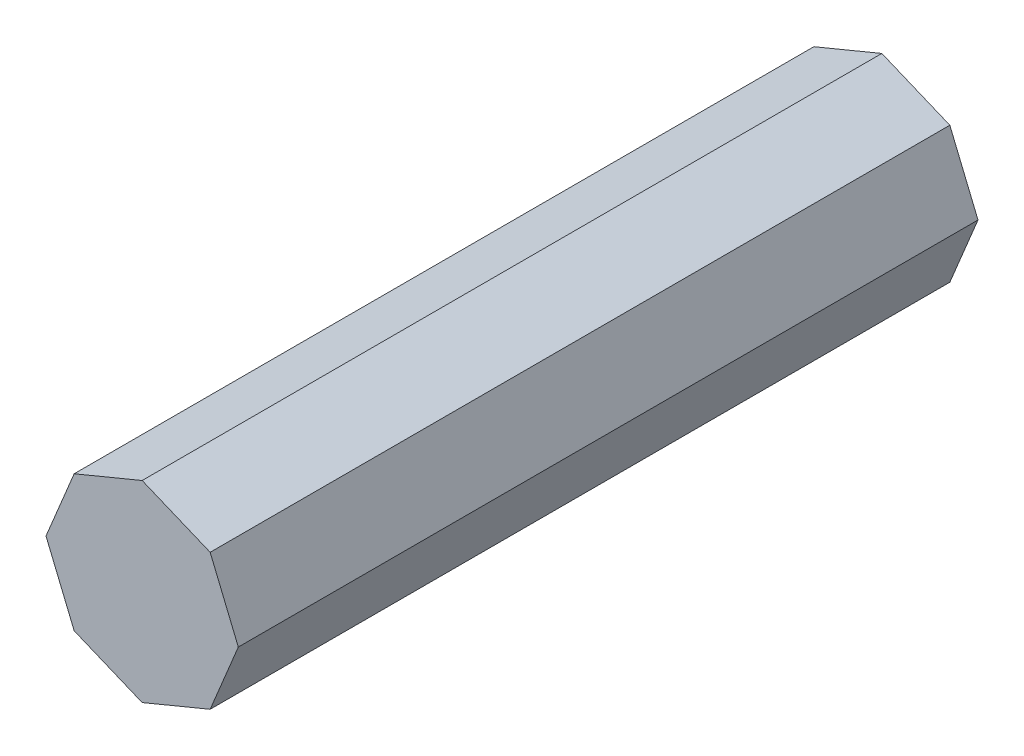
from build123d import *

# Parameters (mm, degrees)
BOSS_EXTRUDE1_DEPTH = 60
BOSS_EXTRUDE2_DEPTH = 60
SKETCH4_W           = 60
SKETCH4_H           = 14.412520708
CUT_EXTRUDE1_DEPTH  = 60


with BuildPart() as part:
    # Sketch2 → Boss-Extrude1 (new body)
    with BuildSketch(Plane.XY):
        Polygon((7.8, 0), (5.515432893, 5.515432893), (0, 7.8), (-5.515432893, 5.515432893), (-7.8, 0), (-5.515432893, -5.515432893), (0, -7.8), (5.515432893, -5.515432893), align=None)
    extrude(amount=BOSS_EXTRUDE1_DEPTH)

    # Sketch3 → Boss-Extrude2 (add)
    with BuildSketch(Plane.XY.offset(60)):
        with BuildLine():
            ThreePointArc((-5.515432893, 5.515432893), (-2.284567107, 5.515432893), (0, 7.8))
            ThreePointArc((0, 7.8), (2.284567107, 5.515432893), (5.515432893, 5.515432893))
            ThreePointArc((5.515432893, 5.515432893), (5.515432893, 2.284567107), (7.8, 0))
            ThreePointArc((7.8, 0), (5.515432893, -2.284567107), (5.515432893, -5.515432893))
            ThreePointArc((5.515432893, -5.515432893), (2.284567107, -5.515432893), (0, -7.8))
            ThreePointArc((0, -7.8), (-2.284567107, -5.515432893), (-5.515432893, -5.515432893))
            ThreePointArc((-5.515432893, -5.515432893), (-4.916369213, -2.036426805), (-7.8, 0))
            ThreePointArc((-7.8, 0), (-5.515432893, 2.284567107), (-5.515432893, 5.515432893))
        make_face()
    extrude(amount=BOSS_EXTRUDE2_DEPTH)

    # Sketch4 → Cut-Extrude1 (cut)
    with BuildSketch(Plane(origin=(-6.657716447, -2.757716447, 0), x_dir=(0, 0, 1), z_dir=(-0.9238795325112824, -0.3826834323651004, 0))):
        with Locations((90, 0)):
            Rectangle(SKETCH4_W, SKETCH4_H)
    extrude(amount=-CUT_EXTRUDE1_DEPTH, mode=Mode.SUBTRACT)


solid = part.part
